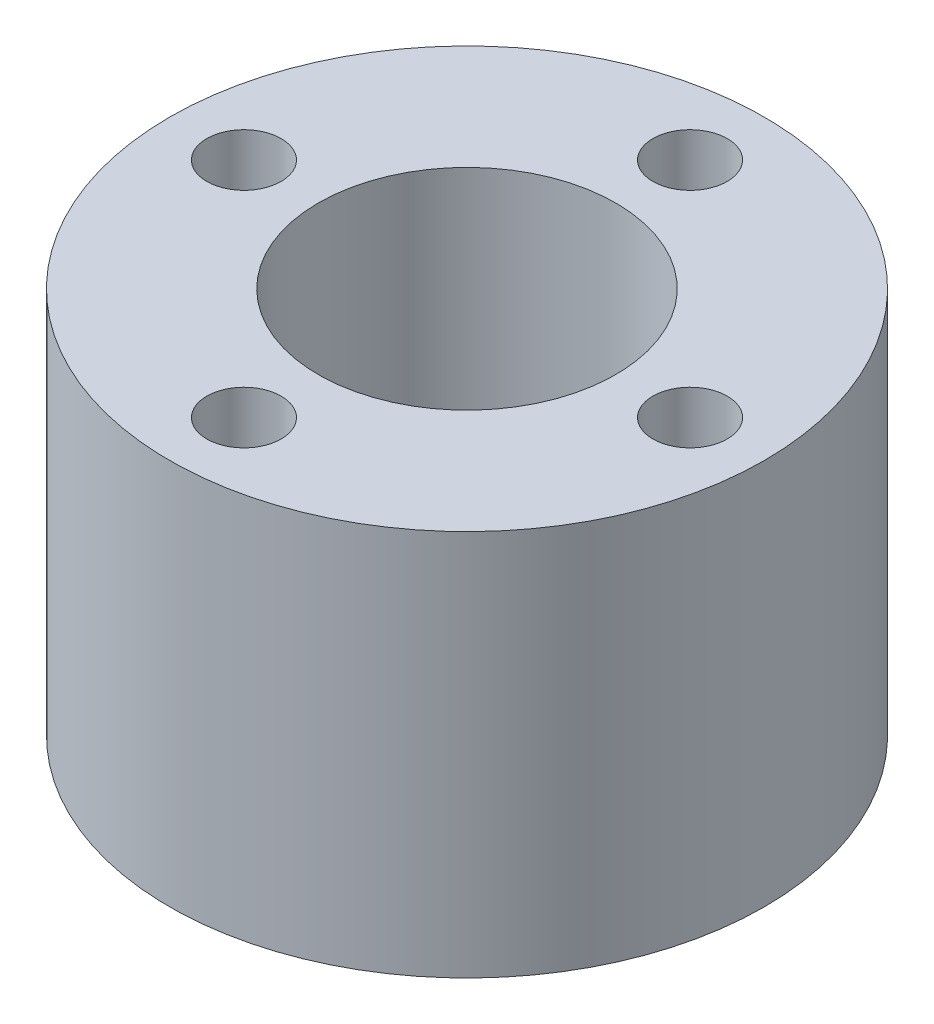
from build123d import *

# Parameters (mm, degrees)
SKETCH_2_W          = 5
SKETCH_2_H          = 13
SKETCH_4_R          = 1.25
CUT_EXTRUDE_1_DEPTH = 20.209372712


with BuildPart() as part:
    # 草图2 → 旋转1 (revolve)
    with BuildSketch(Plane.XY, mode=Mode.PRIVATE) as revolve_1_sk:
        with Locations((7.5, 6.5)):
            Rectangle(SKETCH_2_W, SKETCH_2_H)
    revolve(revolve_1_sk.sketch.rotate(Axis((0, 13, 0), (0, -1, 0)), 180), axis=Axis((0, 13, 0), (0, -1, 0)))

    # 草图4 → 切除-拉伸1 (cut, through all)
    with BuildSketch(Plane(origin=(0, 13, 0), x_dir=(1, 0, 0), z_dir=(0, 1, 0))):
        with Locations(Location((0, 7.5, 0), (0, 0, 270))):
            Circle(SKETCH_4_R)
        with Locations(Location((7.5, 0, 0), (0, 0, 270))):
            Circle(SKETCH_4_R)
        with Locations(Location((0, -7.5, 0), (0, 0, 270))):
            Circle(SKETCH_4_R)
        with Locations(Location((-7.5, 0, 0), (0, 0, 270))):
            Circle(SKETCH_4_R)
    extrude(amount=-CUT_EXTRUDE_1_DEPTH, mode=Mode.SUBTRACT)


solid = part.part
